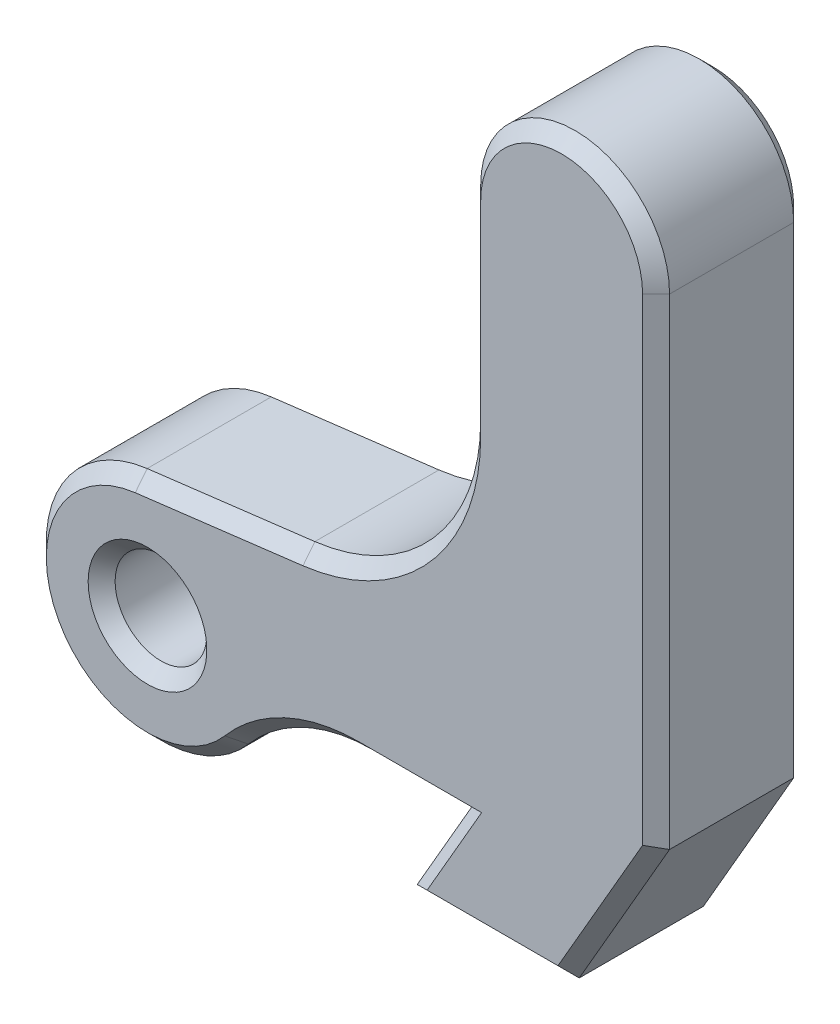
from build123d import *

# Parameters (mm, degrees)
CROQUIS1_R              = 1.7
SALIENTE_EXTRUIR4_DEPTH = 5.6
CHAFL_N3_SIZE           = 0.5


with BuildPart() as part:
    # Croquis1 → Saliente-Extruir4 (new body)
    with BuildSketch(Plane.XY):
        with BuildLine():
            Line((16.09779672, 23.748075599), (16.09779672, 16.177387183))
            ThreePointArc((16.09779672, 16.177387183), (14.340486657, 11.539046724), (9.9508818, 9.229564082))
            Line((9.9508818, 9.229564082), (3.735387364, 8.46639762))
            ThreePointArc((3.735387364, 8.46639762), (0.50668224, 2.230828662), (7.490439371, 1.500080182))
            ThreePointArc((7.490439371, 1.500080182), (9.545533222, 3.0653793), (12.068287742, 3.621510305))
            Line((12.068287742, 3.621510305), (15.766559407, 3.621510305))
            Line((15.766559407, 3.621510305), (13.745833465, 0.121510305))
            Line((13.745833465, 0.121510305), (19.750276265, 0.121510305))
            Line((19.750276265, 0.121510305), (23.097796776, 5.919585909))
            Line((23.097796776, 5.919585909), (23.097796776, 23.748075599))
            ThreePointArc((23.097796776, 23.748075599), (19.597796748, 27.248075627), (16.09779672, 23.748075599))
        make_face()
        with Locations((4.247796776, 4.247400512)):
            Circle(CROQUIS1_R, mode=Mode.SUBTRACT)
    extrude(amount=SALIENTE_EXTRUIR4_DEPTH)

    # Chaflán3
    chafl_n3_edges = [part.edges().sort_by_distance(p)[0] for p in [
        (14.340486657, 11.539046724, 5.6),
        (23.097796776, 14.833830754, 0),
        (21.42403652, 3.020548107, 0),
        (16.748054865, 0.121510305, 0),
        (14.756196436, 1.871510305, 0),
        (13.917423575, 3.621510305, 0),
        (9.545533222, 3.0653793, 0),
        (0.50668224, 2.230828662, 0),
        (6.843134582, 8.847980851, 0),
        (6.843134582, 8.847980851, 5.6),
        (14.340486657, 11.539046724, 0),
        (16.09779672, 19.962731391, 0),
        (19.597796748, 27.248075627, 0),
        (0.50668224, 2.230828662, 5.6),
        (9.545533222, 3.0653793, 5.6),
        (13.917423575, 3.621510305, 5.6),
        (14.756196436, 1.871510305, 5.6),
        (2.547796776, 4.247400512, 0),
        (2.547796776, 4.247400512, 5.6),
        (16.748054865, 0.121510305, 5.6),
        (21.42403652, 3.020548107, 5.6),
        (23.097796776, 14.833830754, 5.6),
        (19.597796748, 27.248075627, 5.6),
        (16.09779672, 19.962731391, 5.6),
    ]]
    chamfer(chafl_n3_edges, length=CHAFL_N3_SIZE)


solid = part.part
